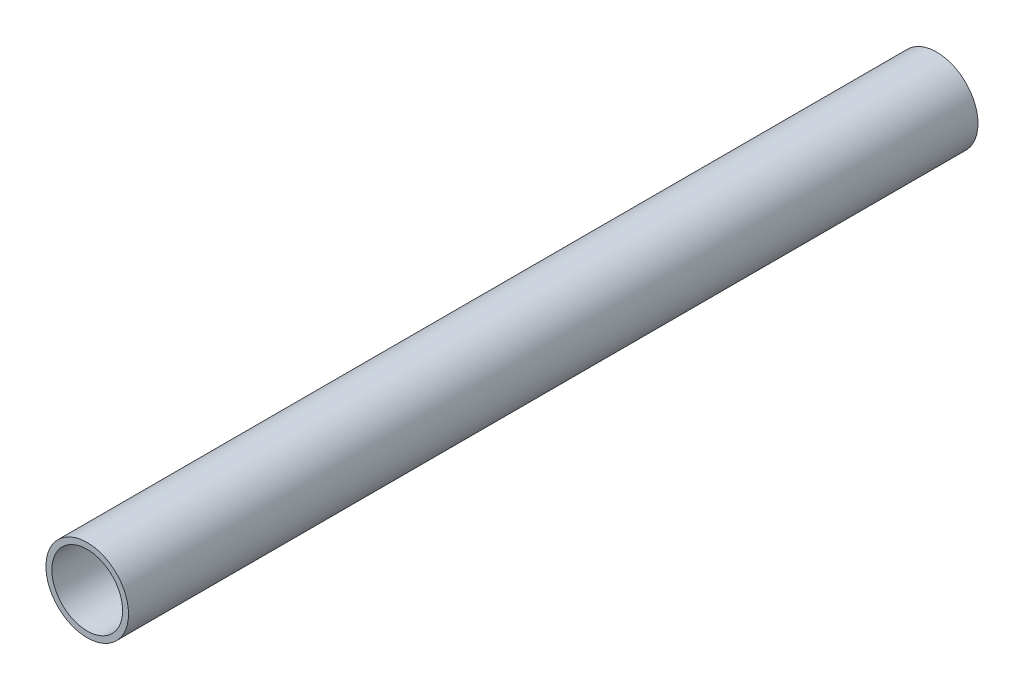
from build123d import *

# Parameters (mm, degrees)
SKETCH1_R           = 11.1125
SKETCH1_R_2         = 9.525
BOSS_EXTRUDE1_DEPTH = 114.3


with BuildPart() as part:
    # Sketch1 → Boss-Extrude1 (new, symmetric)
    with BuildSketch(Plane.XY):
        Circle(SKETCH1_R)
        Circle(SKETCH1_R_2, mode=Mode.SUBTRACT)
    extrude(amount=BOSS_EXTRUDE1_DEPTH, both=True)


solid = part.part
